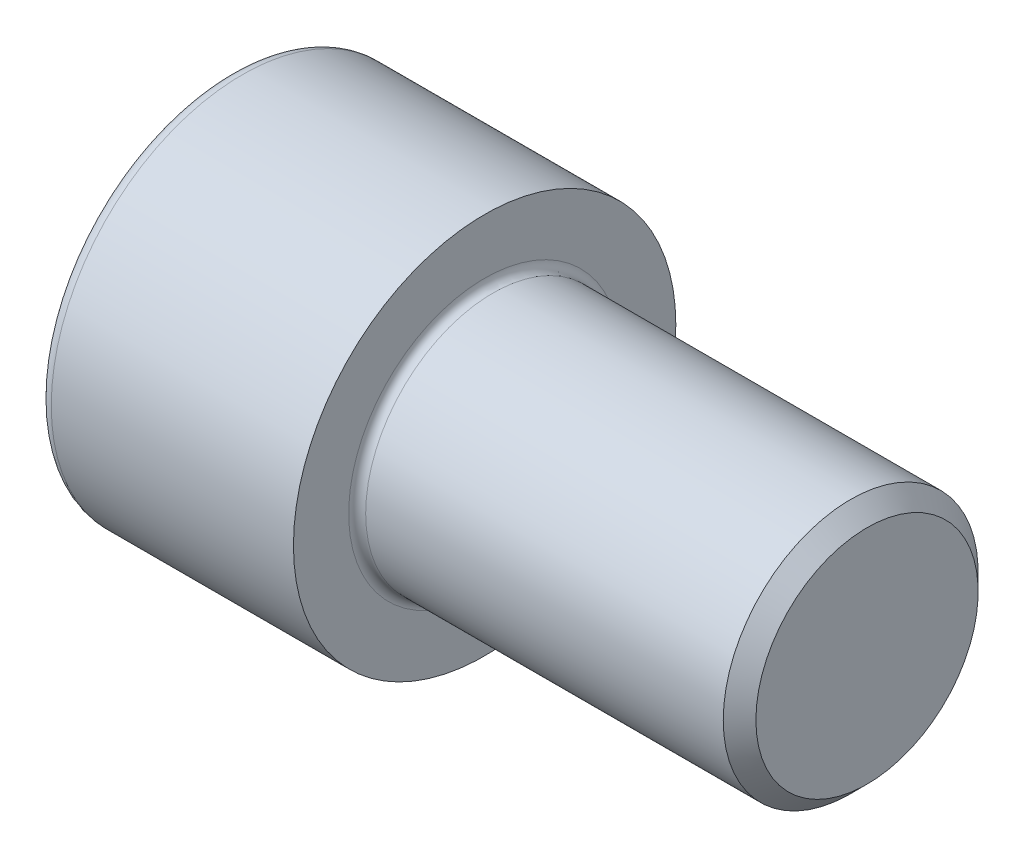
from build123d import *

# Parameters (mm, degrees)
FILLET1_R   = 1
FILLET2_R   = 1.5
HEX_2_DEPTH = 15.5


with BuildPart() as part:
    # BodySke → Base-Revolve (revolve)
    with BuildSketch(Plane.XY, mode=Mode.PRIVATE) as base_revolve_sk:
        Polygon((0, 0), (0, 22.5), (30, 22.5), (30, 15), (73.079, 15), (75, 13.079), (75, 0), align=None)
    revolve(base_revolve_sk.sketch.rotate(Axis((-31.75, 0, 0), (1, 0, 0)), 90), axis=Axis((-31.75, 0, 0), (1, 0, 0)))

    # Fillet1
    fillet1_edges = [part.edges().sort_by_distance(p)[0] for p in [
        (30, 0, -15),
    ]]
    fillet(fillet1_edges, radius=FILLET1_R)

    # Fillet2
    fillet2_edges = [part.edges().sort_by_distance(p)[0] for p in [
        (0, 0, -22.5),
    ]]
    fillet(fillet2_edges, radius=FILLET2_R)

    # Sketch2 → Hex-PreBroach (revolve, cut)
    with BuildSketch(Plane.XY, mode=Mode.PRIVATE) as hex_prebroach_sk:
        Polygon((0, 11.1375), (15.5, 11.1375), (21.930238623, 0), (0, 0), align=None)
    revolve(hex_prebroach_sk.sketch.rotate(Axis((0, 0, 0), (1, 0, 0)), 90), axis=Axis((0, 0, 0), (1, 0, 0)), mode=Mode.SUBTRACT)

    # Sketch3 → Hex 2 (cut)
    with BuildSketch(Plane(origin=(0, 0, 0), x_dir=(0, 0.500000000000001, 0.866025403784438), z_dir=(-1, 0, 0))):
        Polygon((6.430238623, 11.1375), (-6.430238623, 11.1375), (-12.860477246, 0), (-6.430238623, -11.1375), (6.430238623, -11.1375), (12.860477246, 0), align=None)
    extrude(amount=-HEX_2_DEPTH, mode=Mode.SUBTRACT)


solid = part.part
